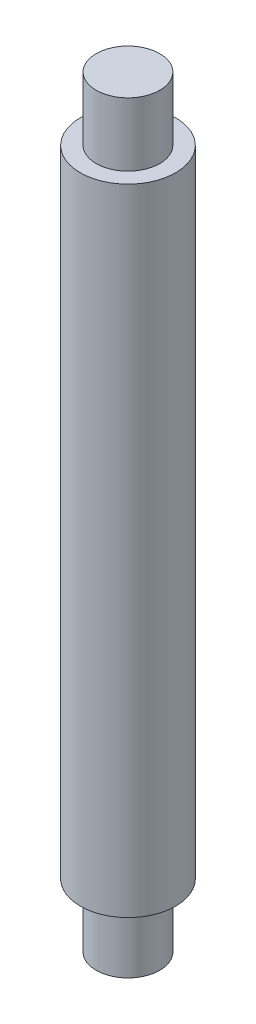
from build123d import *

# Parameters (mm, degrees)
ESQUISSE1_R        = 3
BOSS_EXTRU_1_DEPTH = 40
ESQUISSE2_R        = 2
BOSS_EXTRU_2_DEPTH = 4
ESQUISSE3_R        = 2.000006123
BOSS_EXTRU_3_DEPTH = 4


with BuildPart() as part:
    # Esquisse1 → Boss.-Extru.1 (new body)
    with BuildSketch(Plane(origin=(0, 0, 0), x_dir=(1, 0, 0), z_dir=(0, 1, 0))):
        with Locations(Location((0, 0, 0), (0, 0, 270))):
            Circle(ESQUISSE1_R)
    extrude(amount=BOSS_EXTRU_1_DEPTH)

    # Esquisse2 → Boss.-Extru.2 (add)
    with BuildSketch(Plane(origin=(0, 40, 0), x_dir=(1, 0, 0), z_dir=(0, 1, 0))):
        with Locations(Location((0, 0, 0), (0, 0, 270))):
            Circle(ESQUISSE2_R)
    extrude(amount=BOSS_EXTRU_2_DEPTH)

    # Esquisse3 → Boss.-Extru.3 (add)
    with BuildSketch(Plane.XZ):
        with Locations(Location((0, 0, 0), (0, 0, 270))):
            Circle(ESQUISSE3_R)
    extrude(amount=BOSS_EXTRU_3_DEPTH)


solid = part.part
